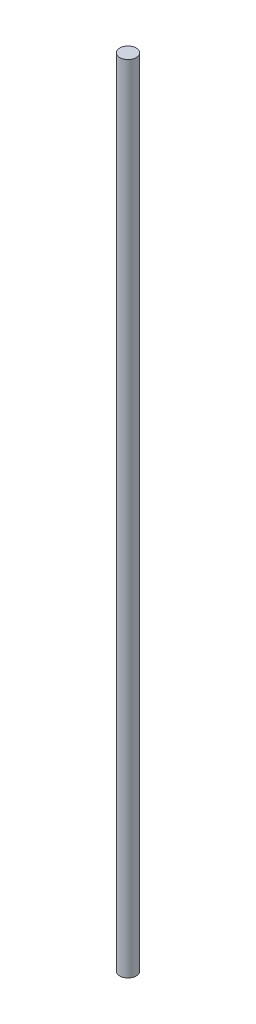
from build123d import *

# Parameters (mm, degrees)
SKETCH1_R           = 25.4
BOSS_EXTRUDE1_DEPTH = 2438.4


with BuildPart() as part:
    # Sketch1 → Boss-Extrude1 (new body)
    with BuildSketch(Plane(origin=(0, 0, 0), x_dir=(1, 0, 0), z_dir=(0, 1, 0))):
        with Locations(Location((0, 0, 0), (0, 0, 90))):
            Circle(SKETCH1_R)
    extrude(amount=BOSS_EXTRUDE1_DEPTH)


solid = part.part
